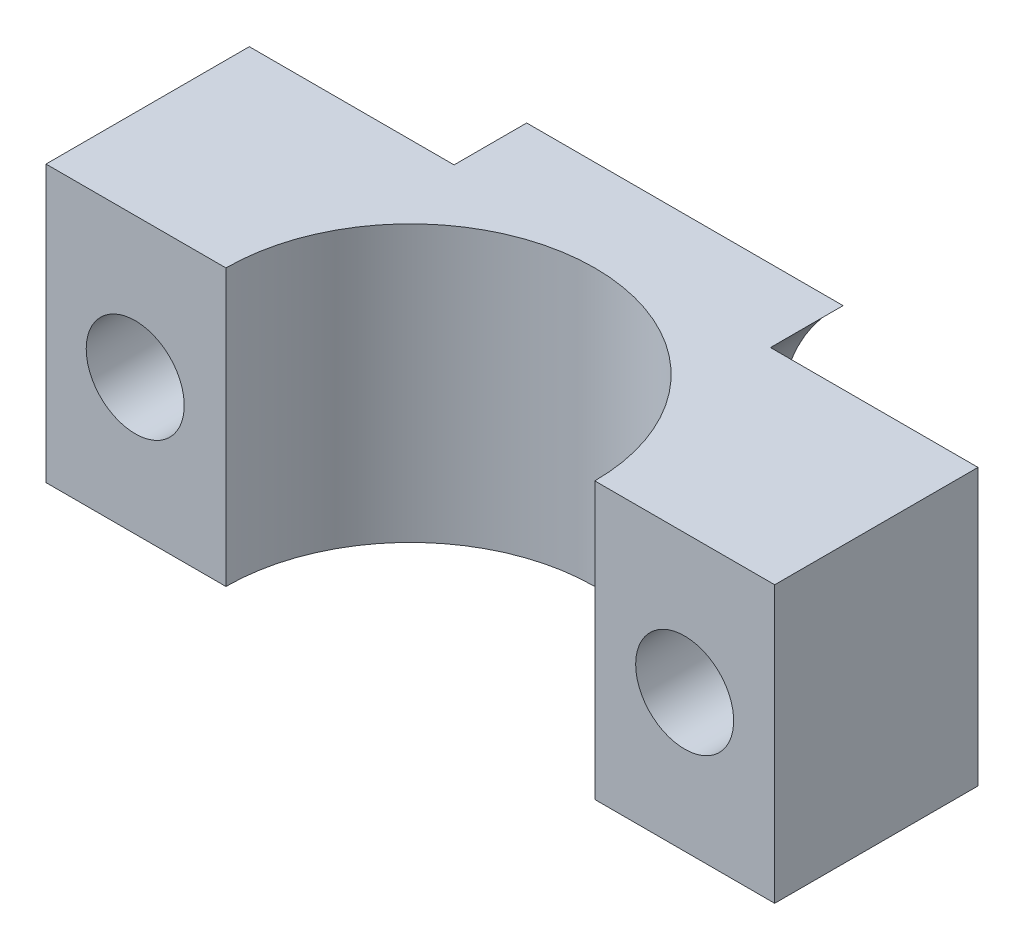
from build123d import *

# Parameters (mm, degrees)
BOSS_EXTRUDE2_DEPTH                      = 9.5
CBORE_FOR_M12_HEX_HEAD_BOLT2_D           = 6.75
CBORE_FOR_M12_HEX_HEAD_BOLT2_CBORE_D     = 25
CBORE_FOR_M12_HEX_HEAD_BOLT2_CBORE_DEPTH = 5


with BuildPart() as part:
    # Sketch1 → Boss-Extrude2 (new, symmetric)
    with BuildSketch(Plane(origin=(0, 0, 0), x_dir=(1, 0, 0), z_dir=(0, 1, 0))):
        with BuildLine():
            ThreePointArc((-12.7, 0), (0, 12.7), (12.7, 0))
            Line((12.7, 0), (25.09, 0))
            Line((25.09, 0), (25.09, 19))
            Line((25.09, 19), (-25.09, 19))
            Line((-25.09, 19), (-25.09, 0))
            Line((-25.09, 0), (-12.7, 0))
        make_face()
    extrude(amount=BOSS_EXTRUDE2_DEPTH, both=True)

    # CBORE for M12 Hex Head Bolt2 (through all)
    with Locations(Plane(origin=(18.889837659, -0.028068109, -19), x_dir=(-1, 0, 0), z_dir=(0, 0, -1))):
        with Locations((0, 0), (37.835811537, -0.112272438)):
            CounterBoreHole(CBORE_FOR_M12_HEX_HEAD_BOLT2_D / 2, CBORE_FOR_M12_HEX_HEAD_BOLT2_CBORE_D / 2, CBORE_FOR_M12_HEX_HEAD_BOLT2_CBORE_DEPTH)


solid = part.part
